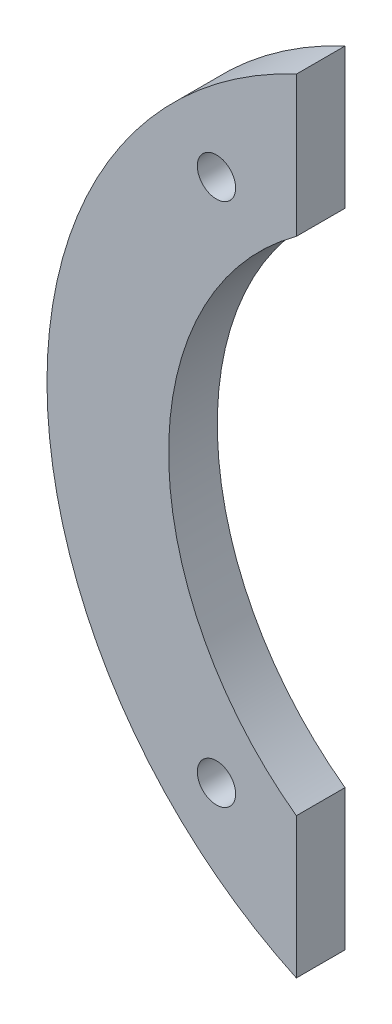
from build123d import *

# Parameters (mm, degrees)
SKETCH_1_R          = 35.5
SKETCH_1_R_2        = 25.5
EXTRUDE_1_DEPTH     = 4
SKETCH_2_R          = 1.575
CUT_EXTRUDE_1_DEPTH = 51.363677388
SKETCH_3_W          = 60
SKETCH_3_H          = 80
CUT_EXTRUDE_2_DEPTH = 51.363677388


with BuildPart() as part:
    # 草图1 → 凸台-拉伸1 (new body)
    with BuildSketch(Plane.XY):
        Circle(SKETCH_1_R)
        Circle(SKETCH_1_R_2, mode=Mode.SUBTRACT)
    extrude(amount=EXTRUDE_1_DEPTH)

    # 草图2 → 切除-拉伸1 (cut, through all)
    with BuildSketch(Plane.XY.offset(4)):
        with Locations((-21.566756826, 21.566756826)):
            Circle(SKETCH_2_R)
        with Locations((21.566756826, 21.566756826)):
            Circle(SKETCH_2_R)
        with Locations((21.566756826, -21.566756826)):
            Circle(SKETCH_2_R)
        with Locations((-21.566756826, -21.566756826)):
            Circle(SKETCH_2_R)
    extrude(amount=-CUT_EXTRUDE_1_DEPTH, mode=Mode.SUBTRACT)

    # 草图3 → 切除-拉伸2 (cut, through all)
    with BuildSketch(Plane.XY.offset(4)):
        with Locations((15, 0)):
            Rectangle(SKETCH_3_W, SKETCH_3_H)
    extrude(amount=-CUT_EXTRUDE_2_DEPTH, mode=Mode.SUBTRACT)


solid = part.part
